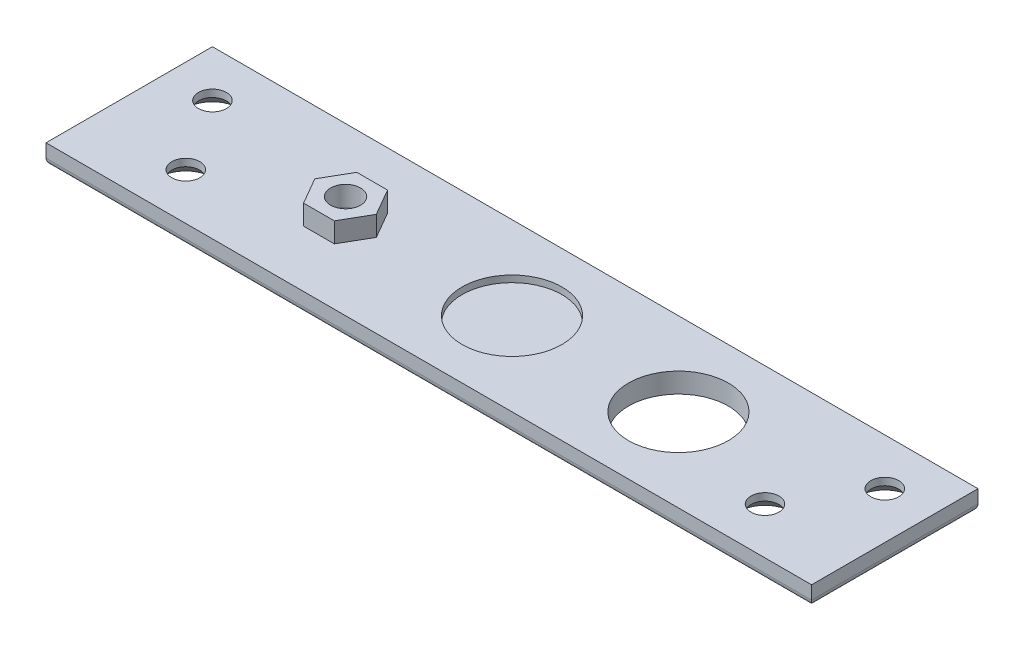
from build123d import *

# Parameters (mm, degrees)
ESBO_O1_W                           = 115
ESBO_O1_H                           = 25
RESSALTO_EXTRUS_O1_DEPTH            = 1.5
ESBO_O2_R                           = 7.5
CORTE_EXTRUS_O1_DEPTH               = 59.919436521
ESBO_O2_3_R                         = 7.5
CORTE_EXTRUS_O2_DEPTH               = 1
ESCAREADO_PARA_SFHCS_M51_AT_2_COUNT = 2
ESCAREADO_PARA_SFHCS_M51_AT_2_PITCH = 13.03840481
ESCAREADO_PARA_SFHCS_M51_AT_3_COUNT = 2
ESCAREADO_PARA_SFHCS_M51_AT_3_PITCH = 94.641428561
ESCAREADO_PARA_SFHCS_M51_AT_4_COUNT = 2
ESCAREADO_PARA_SFHCS_M51_AT_4_PITCH = 101
FILETE1_R                           = 1
ESBO_O7_R                           = 2.25
RESSALTO_EXTRUS_O2_DEPTH            = 3


with BuildPart() as part:
    # Esboço1 → Ressalto-extrusão1 (new, symmetric)
    with BuildSketch(Plane(origin=(0, 0, 0), x_dir=(1, 0, 0), z_dir=(0, 1, 0))):
        Rectangle(ESBO_O1_W, ESBO_O1_H)
    extrude(amount=RESSALTO_EXTRUS_O1_DEPTH, both=True)

    # Esboço2 → Corte-extrusão1 (cut, through all)
    with BuildSketch(Plane(origin=(0, 1.5, 0), x_dir=(1, 0, 0), z_dir=(0, 1, 0))):
        with Locations((25, 0)):
            Circle(ESBO_O2_R)
    extrude(amount=-CORTE_EXTRUS_O1_DEPTH, mode=Mode.SUBTRACT)

    # Esboço2<3> → Corte-extrusão2 (cut)
    with BuildSketch(Plane(origin=(0, 1.5, 0), x_dir=(1, 0, 0), z_dir=(0, 1, 0))):
        Circle(ESBO_O2_3_R)
    extrude(amount=-CORTE_EXTRUS_O2_DEPTH, mode=Mode.SUBTRACT)

    # Esboço4 → Escareado para SFHCS M51 (revolve, cut)
    with BuildSketch(Plane(origin=(50.5, -1.5, -5.5), x_dir=(0, 0, -1), z_dir=(1, 0, 0))):
        Polygon((0, 0), (0, 3), (2.1, 3), (2.1, 1.9), (4, 0), align=None)
    escareado_para_sfhcs_m51 = revolve(axis=Axis((50.5, -7.85, -5.5), (0, 1, 0)), mode=Mode.SUBTRACT)

    # Escareado para SFHCS M51 at 2: Escareado para SFHCS M51 ×2
    with Locations(*[Vector(-0.5368754921931589, 0, 0.8436614877321078) * (i * ESCAREADO_PARA_SFHCS_M51_AT_2_PITCH) for i in range(1, ESCAREADO_PARA_SFHCS_M51_AT_2_COUNT)]):
        add(escareado_para_sfhcs_m51, mode=Mode.SUBTRACT)

    # Escareado para SFHCS M51 at 3: Escareado para SFHCS M51 ×2
    with Locations(*[Vector(-0.9932225393212899, 0, 0.11622816949504457) * (i * ESCAREADO_PARA_SFHCS_M51_AT_3_PITCH) for i in range(1, ESCAREADO_PARA_SFHCS_M51_AT_3_COUNT)]):
        add(escareado_para_sfhcs_m51, mode=Mode.SUBTRACT)

    # Escareado para SFHCS M51 at 4: Escareado para SFHCS M51 ×2
    with Locations(*[(-i * ESCAREADO_PARA_SFHCS_M51_AT_4_PITCH, 0, 0) for i in range(1, ESCAREADO_PARA_SFHCS_M51_AT_4_COUNT)]):
        add(escareado_para_sfhcs_m51, mode=Mode.SUBTRACT)

    # Filete1
    filete1_edges = [part.edges().sort_by_distance(p)[0] for p in [
        (0, -1.5, -12.5),
        (-57.5, -1.5, 0),
        (57.5, -1.5, 0),
        (0, -1.5, 12.5),
    ]]
    fillet(filete1_edges, radius=FILETE1_R)

    # Esboço6 → Escareado para SFHCS M41 (revolve, cut)
    with BuildSketch(Plane(origin=(-25, -1.5, 0), x_dir=(0, 0, -1), z_dir=(1, 0, 0))):
        Polygon((0, 0), (0, 3), (2.25, 3), (2.25, 2.23), (4.48, 0), align=None)
    revolve(axis=Axis((-25, -7.85, 0), (0, 1, 0)), mode=Mode.SUBTRACT)


with BuildPart() as body_2:
    # Esboço7 → Ressalto-extrusão2 (new body)
    with BuildSketch(Plane(origin=(0, 1.5, 0), x_dir=(1, 0, 0), z_dir=(0, 1, 0))):
        Polygon((-22.690598923, -4), (-20.381197846, 0), (-22.690598923, 4), (-27.309401077, 4), (-29.618802154, 0), (-27.309401077, -4), align=None)
        with Locations((-25, 0)):
            Circle(ESBO_O7_R, mode=Mode.SUBTRACT)
    extrude(amount=RESSALTO_EXTRUS_O2_DEPTH)


solid = Compound([part.part, body_2.part])
